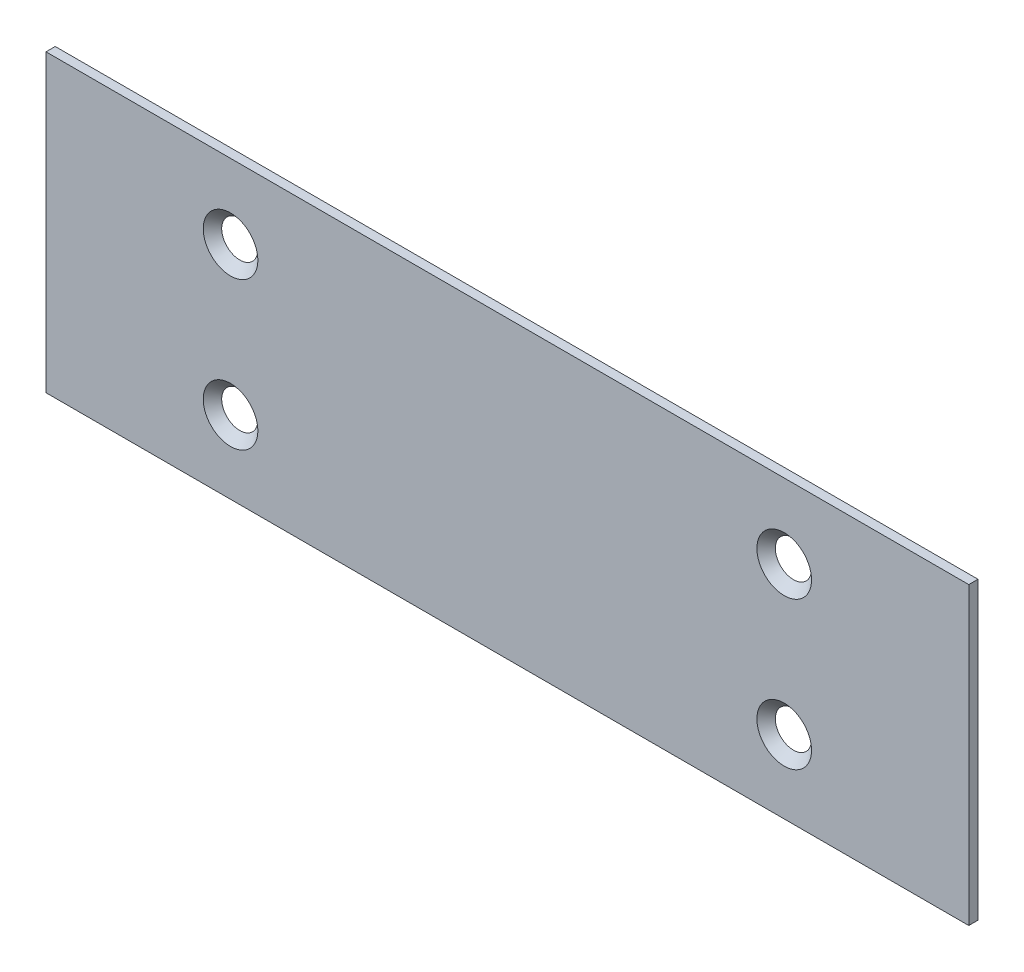
from build123d import *

# Parameters (mm, degrees)
SKETCH1_W                                      = 158.75
SKETCH1_H                                      = 50.8
BOSS_EXTRUDE1_DEPTH                            = 1.5875
CSK_FOR_M4_FLAT_HEAD_MACHINE_SCREW1_AT_2_COUNT = 2
CSK_FOR_M4_FLAT_HEAD_MACHINE_SCREW1_AT_2_PITCH = 25.4
CSK_FOR_M4_FLAT_HEAD_MACHINE_SCREW1_AT_3_COUNT = 2
CSK_FOR_M4_FLAT_HEAD_MACHINE_SCREW1_AT_3_PITCH = 98.578509321
CSK_FOR_M4_FLAT_HEAD_MACHINE_SCREW1_AT_4_COUNT = 2
CSK_FOR_M4_FLAT_HEAD_MACHINE_SCREW1_AT_4_PITCH = 95.25


with BuildPart() as part:
    # Sketch1 → Boss-Extrude1 (new body)
    with BuildSketch(Plane.XY):
        with Locations((-79.375, 25.4)):
            Rectangle(SKETCH1_W, SKETCH1_H)
    extrude(amount=BOSS_EXTRUDE1_DEPTH)

    # Sketch2 → CSK for M4 Flat Head Machine Screw1 (revolve, cut)
    with BuildSketch(Plane(origin=(-127, 37.973, 1.5875), x_dir=(0, -1, 0), z_dir=(1, 0, 0))):
        Polygon((0, 0), (0, 1.5875), (2.25, 1.5875), (2.25, 2.45), (4.7, 0), align=None)
    csk_for_m4_flat_head_machine_screw1 = revolve(axis=Axis((-127, 37.973, 7.9375), (0, 0, -1)), mode=Mode.SUBTRACT)

    # CSK for M4 Flat Head Machine Screw1 at 2: CSK for M4 Flat Head Machine Screw1 ×2
    with Locations(*[(0, -i * CSK_FOR_M4_FLAT_HEAD_MACHINE_SCREW1_AT_2_PITCH, 0) for i in range(1, CSK_FOR_M4_FLAT_HEAD_MACHINE_SCREW1_AT_2_COUNT)]):
        add(csk_for_m4_flat_head_machine_screw1, mode=Mode.SUBTRACT)

    # CSK for M4 Flat Head Machine Screw1 at 3: CSK for M4 Flat Head Machine Screw1 ×2
    with Locations(*[Vector(0.9662349396012463, -0.25766265056033233, 0) * (i * CSK_FOR_M4_FLAT_HEAD_MACHINE_SCREW1_AT_3_PITCH) for i in range(1, CSK_FOR_M4_FLAT_HEAD_MACHINE_SCREW1_AT_3_COUNT)]):
        add(csk_for_m4_flat_head_machine_screw1, mode=Mode.SUBTRACT)

    # CSK for M4 Flat Head Machine Screw1 at 4: CSK for M4 Flat Head Machine Screw1 ×2
    with Locations(*[(i * CSK_FOR_M4_FLAT_HEAD_MACHINE_SCREW1_AT_4_PITCH, 0, 0) for i in range(1, CSK_FOR_M4_FLAT_HEAD_MACHINE_SCREW1_AT_4_COUNT)]):
        add(csk_for_m4_flat_head_machine_screw1, mode=Mode.SUBTRACT)


solid = part.part
